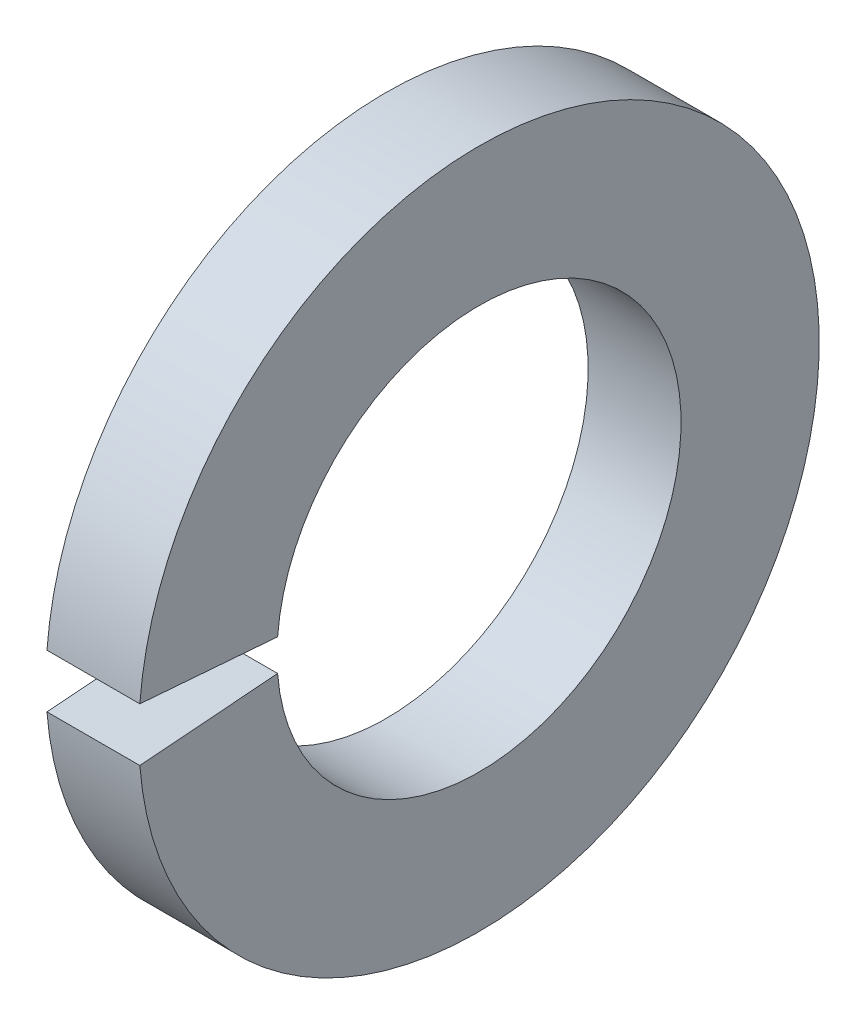
from build123d import *

# Parameters (mm, degrees)
SKETCH1_W      = 1.016
SKETCH1_H      = 1.5113
REVOLVE1_ANGLE = 351


with BuildPart() as part:
    # Sketch1 → Revolve1 (revolve)
    with BuildSketch(Plane(origin=(0, 0, 0), x_dir=(-1, 0, 0), z_dir=(0, 0.996917333733128, 0.07845909572784564))):
        with Locations((0.508, 2.96545)):
            Rectangle(SKETCH1_W, SKETCH1_H)
    revolve(axis=Axis((0, 0, 0), (1, 0, 0)), revolution_arc=REVOLVE1_ANGLE)


solid = part.part
